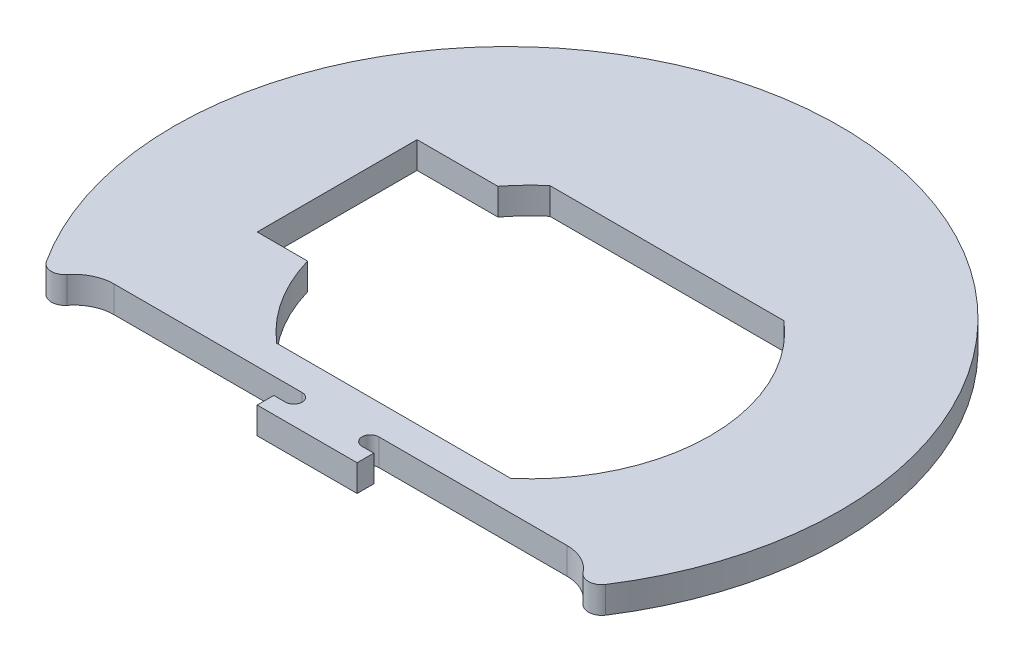
from build123d import *

# Parameters (mm, degrees)
BOSS_EXTRUDE1_DEPTH = 2


with BuildPart() as part:
    # Sketch1 → Boss-Extrude1 (new, symmetric)
    with BuildSketch(Plane(origin=(0, 0, 0), x_dir=(1, 0, 0), z_dir=(0, 1, 0))):
        with BuildLine():
            Line((7.5, -30), (-7.5, -30))
            Line((-7.5, -30), (-7.5, -27.5))
            Line((-7.5, -27.5), (-5.75, -27.5))
            ThreePointArc((-5.75, -27.5), (-4.5, -26.25), (-5.75, -25))
            Line((-5.75, -25), (-34, -25))
            ThreePointArc((-34, -25), (-36.629076053, -25.606674578), (-38.726487571, -27.304013631))
            ThreePointArc((-38.726487571, -27.304013631), (-40.391401006, -28.070018299), (-41.981232738, -27.158352266))
            ThreePointArc((-41.981232738, -27.158352266), (0, 50), (41.981232738, -27.158352266))
            ThreePointArc((41.981232738, -27.158352266), (40.391401006, -28.070018299), (38.726487571, -27.304013631))
            ThreePointArc((38.726487571, -27.304013631), (36.629076053, -25.606674578), (34, -25))
            Line((34, -25), (5.75, -25))
            ThreePointArc((5.75, -25), (4.5, -26.25), (5.75, -27.5))
            Line((5.75, -27.5), (7.5, -27.5))
            Line((7.5, -27.5), (7.5, -30))
        make_face()
        with BuildLine():
            Line((21.071283391, 20.5), (-14.071283391, 20.5))
            ThreePointArc((-14.071283391, 20.5), (-16.073941577, 18.597333441), (-17.871710273, 16.5))
            Line((-17.871710273, 16.5), (-30, 16.5))
            Line((-30, 16.5), (-30, -7.5))
            Line((-30, -7.5), (-22.437424699, -7.5))
            ThreePointArc((-22.437424699, -7.5), (-19.204667359, -14.611573498), (-14.071283391, -20.5))
            Line((-14.071283391, -20.5), (21.071283391, -20.5))
            ThreePointArc((21.071283391, -20.5), (30.5, 0), (21.071283391, 20.5))
        make_face(mode=Mode.SUBTRACT)
    extrude(amount=BOSS_EXTRUDE1_DEPTH, both=True)


solid = part.part
